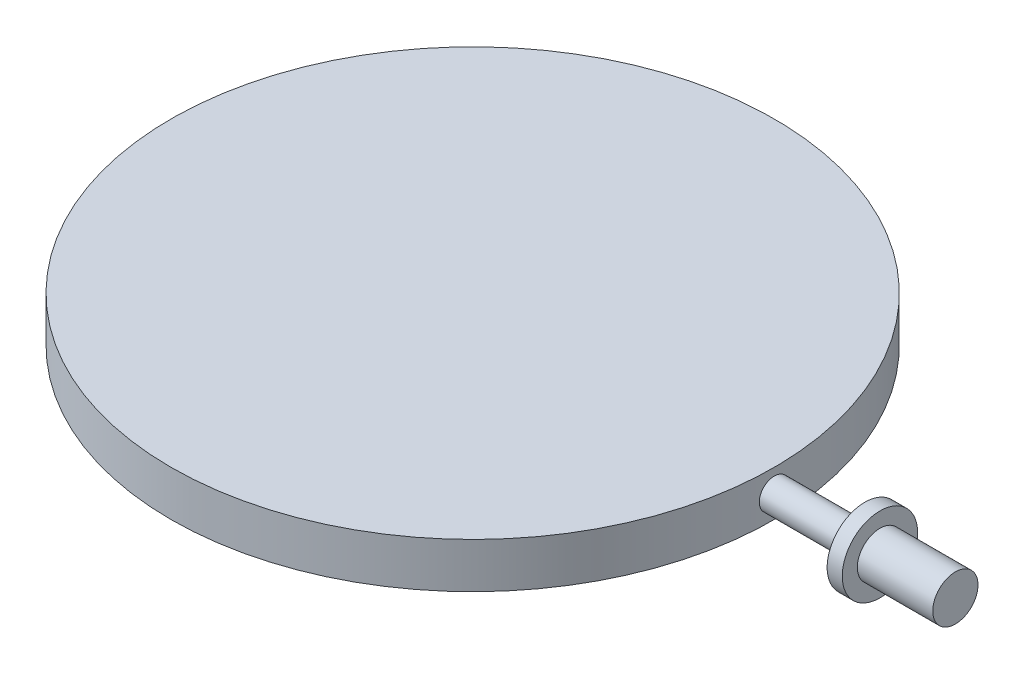
from build123d import *

# Parameters (mm, degrees)
SKETCH1_R           = 100
BOSS_EXTRUDE1_DEPTH = 15
SKETCH2_R           = 5
BOSS_EXTRUDE2_DEPTH = 30
SKETCH3_R           = 12.5
BOSS_EXTRUDE3_DEPTH = 5
SKETCH4_R           = 7.5
BOSS_EXTRUDE4_DEPTH = 25


with BuildPart() as part:
    # Sketch1 → Boss-Extrude1 (new body)
    with BuildSketch(Plane(origin=(0, 0, 0), x_dir=(1, 0, 0), z_dir=(0, 1, 0))):
        with Locations(Location((0, 0, 0), (0, 0, 270))):
            Circle(SKETCH1_R)
    extrude(amount=BOSS_EXTRUDE1_DEPTH)


with BuildPart() as body_2:
    # Sketch2 → Boss-Extrude2 (new body)
    with BuildSketch(Plane(origin=(100, 0, 0), x_dir=(0, 0, -1), z_dir=(1, 0, 0))):
        with Locations((0, 7.5)):
            Circle(SKETCH2_R)
    extrude(amount=BOSS_EXTRUDE2_DEPTH)

    # Sketch3 → Boss-Extrude3 (add)
    with BuildSketch(Plane(origin=(130, 0, 0), x_dir=(0, 0, -1), z_dir=(1, 0, 0))):
        with Locations((0, 7.5)):
            Circle(SKETCH3_R)
    extrude(amount=BOSS_EXTRUDE3_DEPTH)

    # Sketch4 → Boss-Extrude4 (add)
    with BuildSketch(Plane(origin=(135, 0, 0), x_dir=(0, 0, -1), z_dir=(1, 0, 0))):
        with Locations((0, 7.5)):
            Circle(SKETCH4_R)
    extrude(amount=BOSS_EXTRUDE4_DEPTH)


solid = Compound([part.part, body_2.part])
